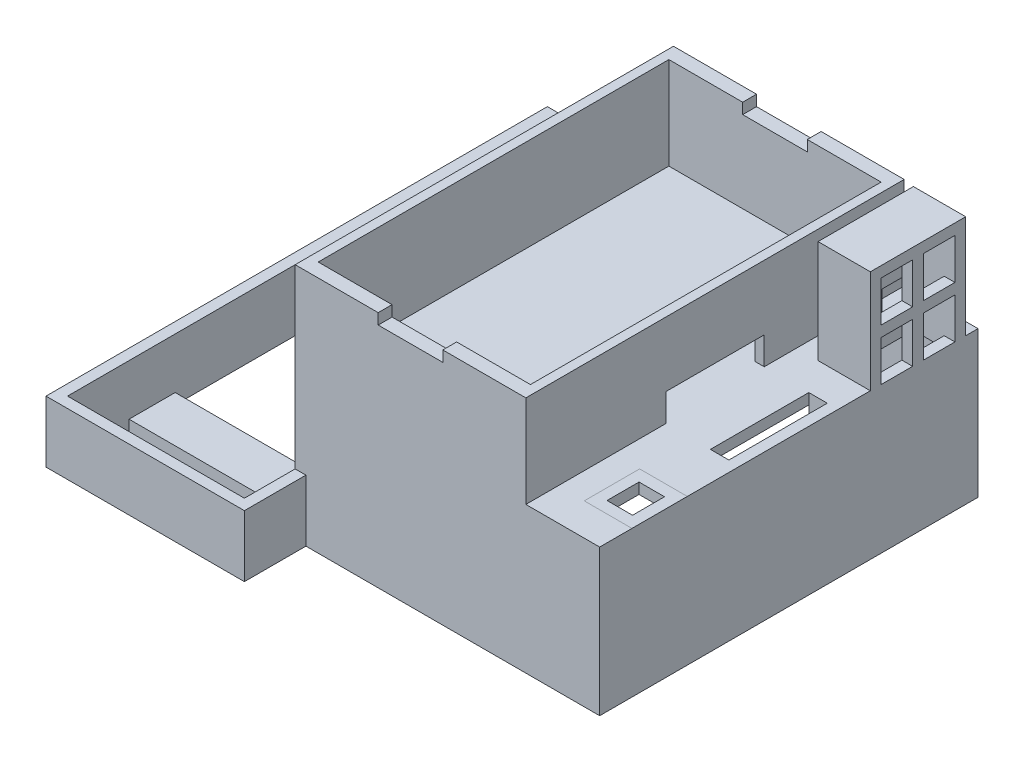
from build123d import *

# Parameters (mm, degrees)
SKETCH1_W               = 49.5
SKETCH1_H               = 61.5
BOSS_EXTRUDE1_DEPTH     = 23.75
SKETCH2_W               = 46
SKETCH2_H               = 58
CUT_EXTRUDE1_DEPTH      = 22
SKETCH3_W               = 3
SKETCH3_H               = 16
CUT_EXTRUDE2_DEPTH      = 1.75
SKETCH7_W               = 3
SKETCH7_H               = 5
BOSS_EXTRUDE2_DEPTH     = 6
SKETCH11_W              = 37.5
SKETCH11_H              = 61.5
BOSS_EXTRUDE3_DEPTH     = 15
SKETCH12_W              = 34.5
SKETCH12_H              = 57
CUT_EXTRUDE3_DEPTH      = 15
SKETCH14_W              = 7.75
SKETCH14_H              = 9
BOSS_EXTRUDE4_DEPTH     = 0.0001
SKETCH15_W              = 4.15
SKETCH15_H              = 5.2
CUT_EXTRUDE4_DEPTH      = 4.75
SKETCH16_W              = 8.5
SKETCH16_H              = 15.5
BOSS_EXTRUDE5_DEPTH     = 16.75
SKETCH17_W              = 5.125
SKETCH17_H              = 6.625
CUT_EXTRUDE5_DEPTH      = 8.5
CUT_EXTRUDE6_DEPTH      = 15
CUT_EXTRUDE6_DEPTH_BACK = 1.75
SKETCH18_W              = 5
SKETCH18_H              = 12
SKETCH20_W              = 16
SKETCH20_H              = 4.5
CUT_EXTRUDE7_DEPTH      = 1.75
SKETCH21_W              = 32.25
SKETCH21_H              = 81.5
BOSS_EXTRUDE7_DEPTH     = 10
SKETCH23_W              = 28.75
SKETCH23_H              = 78
CUT_EXTRUDE8_DEPTH      = 10
SKETCH25_W              = 3
SKETCH25_H              = 5.4
BOSS_EXTRUDE8_DEPTH     = 1.75
SKETCH28_W              = 3
SKETCH28_H              = 2
BOSS_EXTRUDE9_DEPTH     = 1.75
SKETCH30_W              = 5
SKETCH30_H              = 1.5
BOSS_EXTRUDE11_DEPTH    = 1
SKETCH32_W              = 10.5
SKETCH32_H              = 2.25
CUT_EXTRUDE9_DEPTH      = 1.75
SKETCH33_W              = 11
SKETCH33_H              = 11
CUT_EXTRUDE10_DEPTH     = 1
SKETCH34_W              = 11
SKETCH34_H              = 1
BOSS_EXTRUDE12_DEPTH    = 2
SKETCH35_W              = 19
SKETCH35_H              = 10
CUT_EXTRUDE11_DEPTH     = 1.75
SKETCH36_W              = 1.75
SKETCH36_H              = 21.5
CUT_EXTRUDE12_DEPTH     = 5.75
SKETCH37_W              = 7.5
SKETCH37_H              = 7.5
SKETCH37_W_2            = 28.75
BOSS_EXTRUDE13_DEPTH    = 1.75


with BuildPart() as part:
    # Sketch1 → Boss-Extrude1 (new body)
    with BuildSketch(Plane(origin=(0, 0, 0), x_dir=(1, 0, 0), z_dir=(0, 1, 0))):
        with Locations((-113.412024913, -45.391200727)):
            Rectangle(SKETCH1_W, SKETCH1_H)
    extrude(amount=BOSS_EXTRUDE1_DEPTH)

    # Sketch2 → Cut-Extrude1 (cut)
    with BuildSketch(Plane(origin=(0, 0, 0), x_dir=(-1, 0, 0), z_dir=(0, -1, 0))):
        with Locations((113.412024913, -45.391200727)):
            Rectangle(SKETCH2_W, SKETCH2_H)
    extrude(amount=-CUT_EXTRUDE1_DEPTH, mode=Mode.SUBTRACT)

    # Sketch3 → Cut-Extrude2 (cut)
    with BuildSketch(Plane(origin=(0, 22, 0), x_dir=(-1, 0, 0), z_dir=(0, -1, 0))):
        with Locations((91.912024913, -66.391200727)):
            Rectangle(SKETCH3_W, SKETCH3_H)
        with Locations((91.912024913, -24.391200727)):
            Rectangle(SKETCH3_W, SKETCH3_H)
        with Locations((91.912024913, -45.391200727)):
            Rectangle(SKETCH3_W, SKETCH3_H)
    extrude(amount=-CUT_EXTRUDE2_DEPTH, mode=Mode.SUBTRACT)

    # Sketch7 → Boss-Extrude2 (add)
    with BuildSketch(Plane(origin=(0, 22, 0), x_dir=(-1, 0, 0), z_dir=(0, -1, 0))):
        with Locations((91.912024913, -55.891200727)):
            Rectangle(SKETCH7_W, SKETCH7_H)
        with Locations((91.912024913, -34.891200727)):
            Rectangle(SKETCH7_W, SKETCH7_H)
    extrude(amount=BOSS_EXTRUDE2_DEPTH)

    # Sketch11 → Boss-Extrude3 (add)
    with BuildSketch(Plane(origin=(0, 23.75, 0), x_dir=(1, 0, 0), z_dir=(0, 1, 0))):
        with Locations((-119.412024913, -45.391200727)):
            Rectangle(SKETCH11_W, SKETCH11_H)
    extrude(amount=BOSS_EXTRUDE3_DEPTH)

    # Sketch12 → Cut-Extrude3 (cut)
    with BuildSketch(Plane(origin=(0, 38.75, 0), x_dir=(1, 0, 0), z_dir=(0, 1, 0))):
        with Locations((-119.412024913, -45.391200727)):
            Rectangle(SKETCH12_W, SKETCH12_H)
    extrude(amount=-CUT_EXTRUDE3_DEPTH, mode=Mode.SUBTRACT)

    # Sketch14 → Boss-Extrude4 (add)
    with BuildSketch(Plane(origin=(0, 23.75, 0), x_dir=(1, 0, 0), z_dir=(0, 1, 0))):
        with Locations((-92.542024913, -66.391200727)):
            Rectangle(SKETCH14_W, SKETCH14_H)
    extrude(amount=BOSS_EXTRUDE4_DEPTH)

    # Sketch15 → Cut-Extrude4 (cut)
    with BuildSketch(Plane(origin=(0, 23.7501, 0), x_dir=(1, 0, 0), z_dir=(0, 1, 0))):
        with Locations((-92.542024913, -66.391200727)):
            Rectangle(SKETCH15_W, SKETCH15_H)
    extrude(amount=-CUT_EXTRUDE4_DEPTH, mode=Mode.SUBTRACT)

    # Sketch16 → Boss-Extrude5 (add)
    with BuildSketch(Plane(origin=(0, 23.75, 0), x_dir=(1, 0, 0), z_dir=(0, 1, 0))):
        with Locations((-92.912024913, -24.391200727)):
            Rectangle(SKETCH16_W, SKETCH16_H)
    extrude(amount=BOSS_EXTRUDE5_DEPTH)

    # Sketch17 → Cut-Extrude5 (cut)
    with BuildSketch(Plane(origin=(-88.662024913, 0, 0), x_dir=(0, 0, -1), z_dir=(1, 0, 0))):
        with Locations((-27.828700727, 35.4375)):
            Rectangle(SKETCH17_W, SKETCH17_H)
        with Locations((-27.828700727, 27.0625)):
            Rectangle(SKETCH17_W, SKETCH17_H)
        with Locations((-20.953700727, 35.4375)):
            Rectangle(SKETCH17_W, SKETCH17_H)
        with Locations((-20.953700727, 27.0625)):
            Rectangle(SKETCH17_W, SKETCH17_H)
    extrude(amount=-CUT_EXTRUDE5_DEPTH, mode=Mode.SUBTRACT)

    # Sketch18 → Cut-Extrude6 (cut, two sides: drawn at the far end of the back side and taken through both)
    with BuildSketch(Plane(origin=(0, 23.75, 0), x_dir=(1, 0, 0), z_dir=(0, 1, 0)).offset(-CUT_EXTRUDE6_DEPTH_BACK)):
        with Locations((-92.912024913, -24.391200727)):
            Rectangle(SKETCH18_W, SKETCH18_H)
    extrude(amount=CUT_EXTRUDE6_DEPTH + CUT_EXTRUDE6_DEPTH_BACK, mode=Mode.SUBTRACT)

    # Sketch20 → Cut-Extrude7 (cut)
    with BuildSketch(Plane(origin=(-100.662024913, 0, 0), x_dir=(0, 0, -1), z_dir=(1, 0, 0))):
        with Locations((-45.391200727, 26)):
            Rectangle(SKETCH20_W, SKETCH20_H)
    extrude(amount=-CUT_EXTRUDE7_DEPTH, mode=Mode.SUBTRACT)

    # Sketch21 → Boss-Extrude7 (add)
    with BuildSketch(Plane(origin=(0, 0, 0), x_dir=(-1, 0, 0), z_dir=(0, -1, 0))):
        with Locations((152.537024913, -45.391200727)):
            Rectangle(SKETCH21_W, SKETCH21_H)
    extrude(amount=-BOSS_EXTRUDE7_DEPTH)

    # Sketch23 → Cut-Extrude8 (cut)
    with BuildSketch(Plane(origin=(0, 10, 0), x_dir=(1, 0, 0), z_dir=(0, 1, 0))):
        with Locations((-152.537024913, -45.391200727)):
            Rectangle(SKETCH23_W, SKETCH23_H)
    extrude(amount=-CUT_EXTRUDE8_DEPTH, mode=Mode.SUBTRACT)

    # Sketch25 → Boss-Extrude8 (add)
    with BuildSketch(Plane(origin=(0, 22, 0), x_dir=(-1, 0, 0), z_dir=(0, -1, 0))):
        with Locations((91.912024913, -61.091200727)):
            Rectangle(SKETCH25_W, SKETCH25_H)
        with Locations((91.912024913, -71.691200727)):
            Rectangle(SKETCH25_W, SKETCH25_H)
    extrude(amount=-BOSS_EXTRUDE8_DEPTH)

    # Sketch28 → Boss-Extrude9 (add)
    with BuildSketch(Plane(origin=(0, 23.75, 0), x_dir=(1, 0, 0), z_dir=(0, 1, 0))):
        with Locations((-91.912024913, -17.391200727)):
            Rectangle(SKETCH28_W, SKETCH28_H)
        with Locations((-91.912024913, -31.391200727)):
            Rectangle(SKETCH28_W, SKETCH28_H)
    extrude(amount=-BOSS_EXTRUDE9_DEPTH)

    # Sketch30 → Boss-Extrude11 (add)
    with BuildSketch(Plane.ZY.offset(93.412024913)):
        with Locations((55.891200727, 16.75)):
            Rectangle(SKETCH30_W, SKETCH30_H)
        with Locations((34.891200727, 16.75)):
            Rectangle(SKETCH30_W, SKETCH30_H)
    extrude(amount=BOSS_EXTRUDE11_DEPTH)

    # Sketch32 → Cut-Extrude9 (cut)
    with BuildSketch(Plane(origin=(0, 38.75, 0), x_dir=(1, 0, 0), z_dir=(0, 1, 0))):
        with Locations((-119.412024913, -75.016200727)):
            Rectangle(SKETCH32_W, SKETCH32_H)
        with Locations((-119.412024913, -15.766200727)):
            Rectangle(SKETCH32_W, SKETCH32_H)
    extrude(amount=-CUT_EXTRUDE9_DEPTH, mode=Mode.SUBTRACT)

    # Sketch33 → Cut-Extrude10 (cut)
    with BuildSketch(Plane.ZY.offset(90.412024913)):
        with Locations((32.891200727, 5.5)):
            Rectangle(SKETCH33_W, SKETCH33_H)
    extrude(amount=-CUT_EXTRUDE10_DEPTH, mode=Mode.SUBTRACT)

    # Sketch34 → Boss-Extrude12 (add)
    with BuildSketch(Plane.ZY.offset(90.412024913)):
        with Locations((32.891200727, 11.5)):
            Rectangle(SKETCH34_W, SKETCH34_H)
        Polygon((38.391200727, 12), (38.391200727, 11), (38.391200727, 0), (39.391200727, 0), (39.391200727, 12), align=None)
        Polygon((26.391200727, 0), (27.391200727, 0), (27.391200727, 11), (27.391200727, 12), (26.391200727, 12), align=None)
    extrude(amount=BOSS_EXTRUDE12_DEPTH)

    # Sketch35 → Cut-Extrude11 (cut)
    with BuildSketch(Plane(origin=(0, 0, 14.641200727), x_dir=(-1, 0, 0), z_dir=(0, 0, -1))):
        with Locations((123.412024913, 5)):
            Rectangle(SKETCH35_W, SKETCH35_H)
    extrude(amount=-CUT_EXTRUDE11_DEPTH, mode=Mode.SUBTRACT)

    # Sketch36 → Cut-Extrude12 (cut)
    with BuildSketch(Plane(origin=(0, 0, 0), x_dir=(-1, 0, 0), z_dir=(0, -1, 0))):
        with Locations((137.287024913, -45.391200727)):
            Rectangle(SKETCH36_W, SKETCH36_H)
    extrude(amount=-CUT_EXTRUDE12_DEPTH, mode=Mode.SUBTRACT)

    # Sketch37 → Boss-Extrude13 (add)
    with BuildSketch(Plane(origin=(0, 0, 0), x_dir=(-1, 0, 0), z_dir=(0, -1, 0))):
        with Locations((94.162024913, -70.641200727)):
            Rectangle(SKETCH37_W, SKETCH37_H)
        with Locations((94.162024913, -20.141200727)):
            Rectangle(SKETCH37_W, SKETCH37_H)
        with Locations((152.537024913, -70.641200727)):
            Rectangle(SKETCH37_W_2, SKETCH37_H)
        with Locations((152.537024913, -20.141200727)):
            Rectangle(SKETCH37_W_2, SKETCH37_H)
    extrude(amount=-BOSS_EXTRUDE13_DEPTH)


solid = part.part
